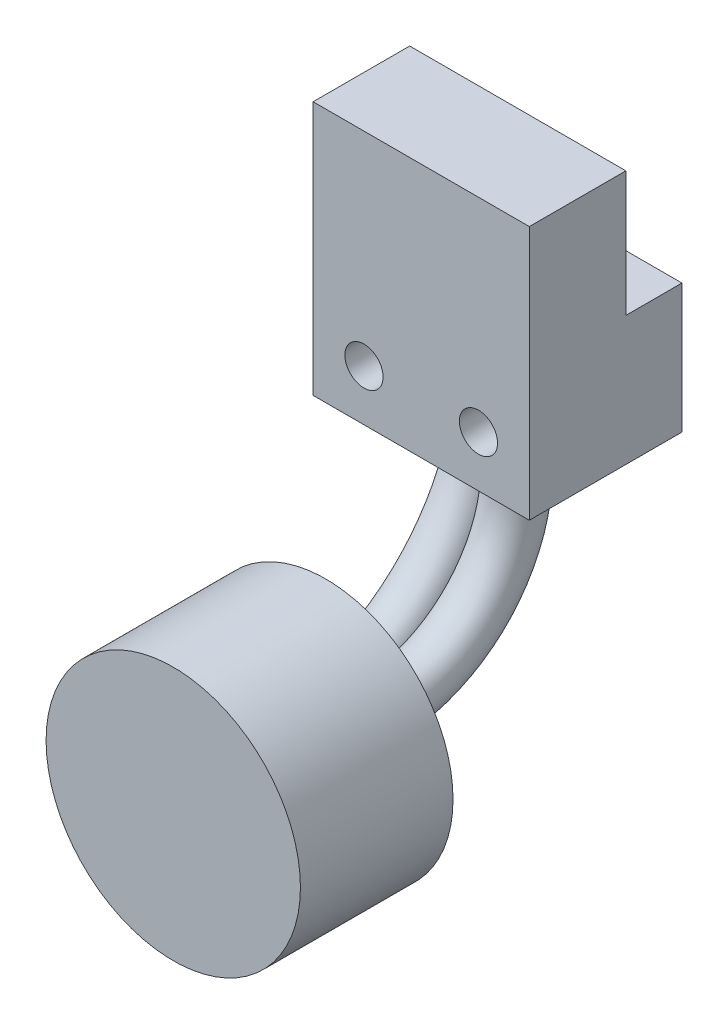
from build123d import *

# Parameters (mm, degrees)
SKICA1_R                 = 50
P_IDAT_VYSUNUT_M1_DEPTH  = 60
SKICA2_R                 = 10
ROTOVAT1_ANGLE           = 90
SKICA3_W                 = 85
SKICA3_H                 = 60
P_IDAT_VYSUNUT_M2_DEPTH  = 100
SKICA4_W                 = 26.634802258
SKICA4_H                 = 52.894466455
ODEBRAT_VYSUNUT_M2_DEPTH = 100
SKICA5_R                 = 7.5
ODEBRAT_VYSUNUT_M3_DEPTH = 100


with BuildPart() as part:
    # Skica1 → Přidat vysunutím1 (new body)
    with BuildSketch(Plane.XY):
        Circle(SKICA1_R)
    extrude(amount=P_IDAT_VYSUNUT_M1_DEPTH)

    # Skica2 → Rotovat1 (revolve)
    with BuildSketch(Plane(origin=(0, 0, 0), x_dir=(-1, 0, 0), z_dir=(0, 0, -1))):
        with Locations((20, -15)):
            Circle(SKICA2_R)
        with Locations((-20, 15)):
            Circle(SKICA2_R)
    revolve(axis=Axis((-92.809652782, 70, 0), (1, 0, 0)), revolution_arc=ROTOVAT1_ANGLE)

    # Skica3 → Přidat vysunutím2 (add)
    with BuildSketch(Plane(origin=(0, 70, 0), x_dir=(1, 0, 0), z_dir=(0, 1, 0))):
        with Locations((-2.5, 70)):
            Rectangle(SKICA3_W, SKICA3_H)
    extrude(amount=P_IDAT_VYSUNUT_M2_DEPTH)

    # Skica4 → Odebrat vysunutím2 (cut)
    with BuildSketch(Plane.ZY.offset(45)):
        with Locations((-91.276231393, 147.219598942)):
            Rectangle(SKICA4_W, SKICA4_H)
    extrude(amount=-ODEBRAT_VYSUNUT_M2_DEPTH, mode=Mode.SUBTRACT)

    # Skica5 → Odebrat vysunutím3 (cut)
    with BuildSketch(Plane.XY.offset(-40)):
        with Locations((20, 90)):
            Circle(SKICA5_R)
        with Locations((-25, 90)):
            Circle(SKICA5_R)
    extrude(amount=-ODEBRAT_VYSUNUT_M3_DEPTH, mode=Mode.SUBTRACT)


solid = part.part
